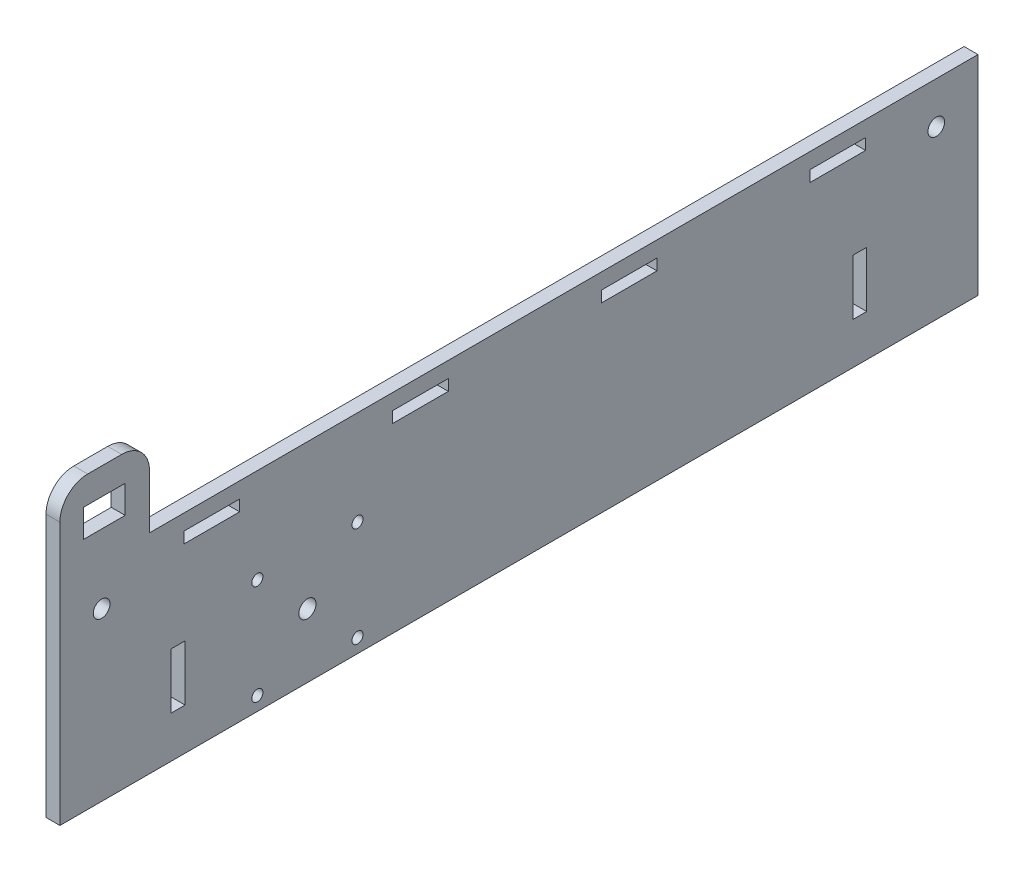
from build123d import *

# Parameters (mm, degrees)
SKETCH5_R           = 3
SKETCH5_W           = 20
SKETCH5_H           = 4
SKETCH5_W_2         = 15
SKETCH5_H_2         = 10
BOSS_EXTRUDE1_DEPTH = 5
SKETCH6_W           = 330
SKETCH6_H           = 15
BOSS_EXTRUDE2_DEPTH = 5
SKETCH8_R           = 2
SKETCH8_R_2         = 3.1
CUT_EXTRUDE1_DEPTH  = 5


with BuildPart() as part:
    # Sketch5 → Boss-Extrude1 (new body)
    with BuildSketch(Plane(origin=(0, 0, 0), x_dir=(0, 0, -1), z_dir=(1, 0, 0))):
        with BuildLine():
            Line((-40, -10), (0, -10))
            Line((0, -10), (0, 0))
            Line((0, 0), (0, 10))
            Line((0, 10), (5, 10))
            Line((5, 10), (5, 0))
            Line((5, 0), (5, -10))
            Line((5, -10), (245, -10))
            Line((245, -10), (245, 0))
            Line((245, 0), (245, 10))
            Line((245, 10), (250, 10))
            Line((250, 10), (250, 0))
            Line((250, 0), (250, -10))
            Line((250, -10), (290, -10))
            Line((290, -10), (290, 50))
            Line((290, 50), (-7.797224701, 50))
            Line((-7.797224701, 50), (-7.797224701, 69.428123594))
            ThreePointArc((-7.797224701, 69.428123594), (-10.726156889, 76.499191405), (-17.797224701, 79.428123594))
            Line((-17.797224701, 79.428123594), (-30, 79.428123594))
            ThreePointArc((-30, 79.428123594), (-37.071067812, 76.499191405), (-40, 69.428123594))
            Line((-40, 69.428123594), (-40, 50))
            Line((-40, 50), (-40, -10))
        make_face()
        with Locations((-25, 35)):
            Circle(SKETCH5_R, mode=Mode.SUBTRACT)
        with Locations((275, 35)):
            Circle(SKETCH5_R, mode=Mode.SUBTRACT)
        with Locations((89.606343961, 42.344097949)):
            Rectangle(SKETCH5_W, SKETCH5_H, mode=Mode.SUBTRACT)
        with Locations((14.606343961, 42.344097949)):
            Rectangle(SKETCH5_W, SKETCH5_H, mode=Mode.SUBTRACT)
        with Locations((-24.047224701, 64.816848726)):
            Rectangle(SKETCH5_W_2, SKETCH5_H_2, mode=Mode.SUBTRACT)
        with Locations((164.606343961, 42.344097949)):
            Rectangle(SKETCH5_W, SKETCH5_H, mode=Mode.SUBTRACT)
        with Locations((239.606343961, 42.344097949)):
            Rectangle(SKETCH5_W, SKETCH5_H, mode=Mode.SUBTRACT)
    extrude(amount=BOSS_EXTRUDE1_DEPTH)

    # Sketch6 → Boss-Extrude2 (add)
    with BuildSketch(Plane(origin=(5, 0, 0), x_dir=(0, 0, -1), z_dir=(1, 0, 0))):
        with Locations((125, -17.5)):
            Rectangle(SKETCH6_W, SKETCH6_H)
    extrude(amount=-BOSS_EXTRUDE2_DEPTH)

    # Sketch8 → Cut-Extrude1 (cut)
    with BuildSketch(Plane(origin=(5, 0, 0), x_dir=(0, 0, -1), z_dir=(1, 0, 0))):
        with Locations((30.968640194, 16)):
            Circle(SKETCH8_R)
        with Locations((30.968640194, -20)):
            Circle(SKETCH8_R)
        with Locations(Location((66.968640194, -20, 0), (0, 0, 180))):
            Circle(SKETCH8_R)
        with Locations(Location((66.968640194, 16, 0), (0, 0, 180))):
            Circle(SKETCH8_R)
        with Locations((48.968640194, -2)):
            Circle(SKETCH8_R_2)
    extrude(amount=-CUT_EXTRUDE1_DEPTH, mode=Mode.SUBTRACT)


solid = part.part
